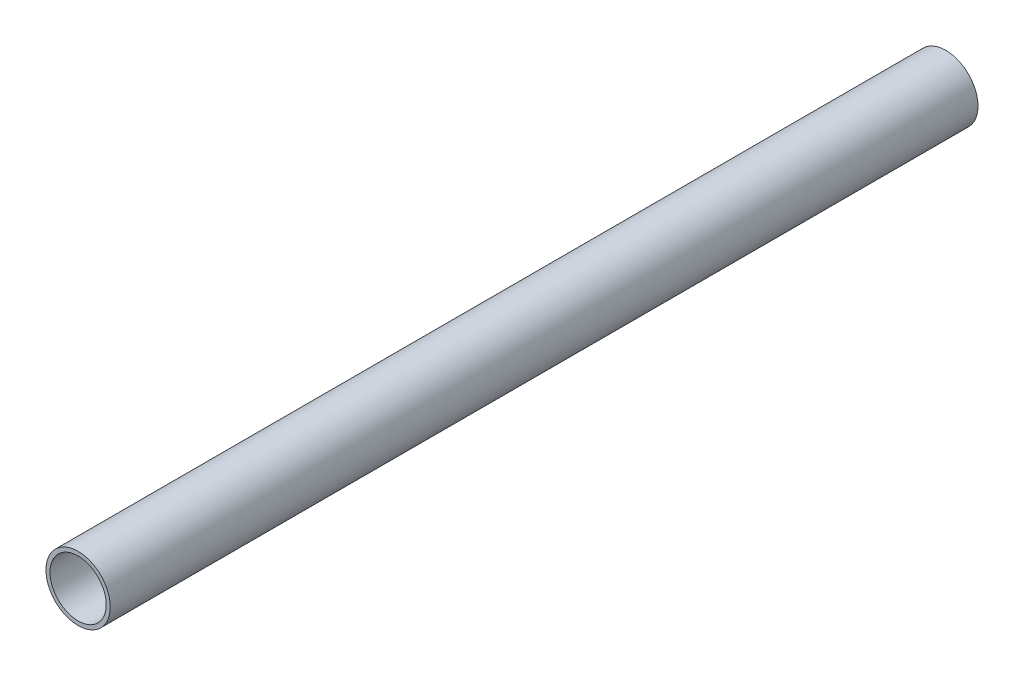
from build123d import *

# Parameters (mm, degrees)
SKETCH1_R           = 12.7
SKETCH1_R_2         = 11.1125
BOSS_EXTRUDE1_DEPTH = 342.62


with BuildPart() as part:
    # Sketch1 → Boss-Extrude1 (new body)
    with BuildSketch(Plane.XY):
        Circle(SKETCH1_R)
        Circle(SKETCH1_R_2, mode=Mode.SUBTRACT)
    extrude(amount=BOSS_EXTRUDE1_DEPTH)


solid = part.part
